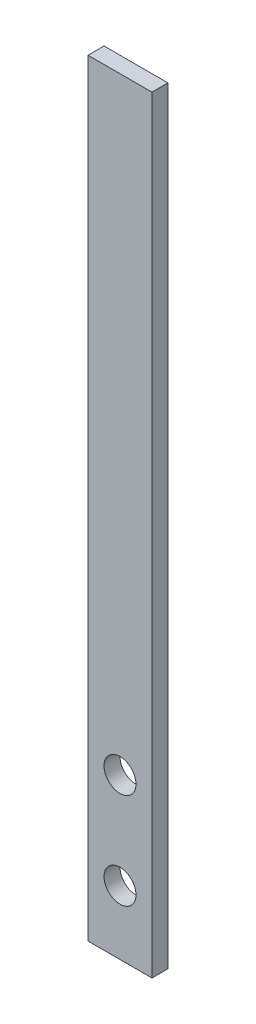
from build123d import *

# Parameters (mm, degrees)
BOSS_EXTRUDE1_DEPTH = 304.8
SKETCH3_R           = 6.35
CUT_EXTRUDE1_DEPTH  = 355.6


with BuildPart() as part:
    # Sketch2 → Boss-Extrude1 (new body)
    with BuildSketch(Plane(origin=(0, 0, 0), x_dir=(1, 0, 0), z_dir=(0, 1, 0))):
        Polygon((0, 1.5875), (0, 0), (20.6375, 0), (25.4, 0), (25.4, 6.35), (0, 6.35), align=None)
    extrude(amount=BOSS_EXTRUDE1_DEPTH)

    # Sketch3 → Cut-Extrude1 (cut)
    with BuildSketch(Plane.XY):
        with Locations((12.7, 25.4)):
            Circle(SKETCH3_R)
        with Locations((12.7, 63.5)):
            Circle(SKETCH3_R)
    extrude(amount=-CUT_EXTRUDE1_DEPTH, mode=Mode.SUBTRACT)


solid = part.part
